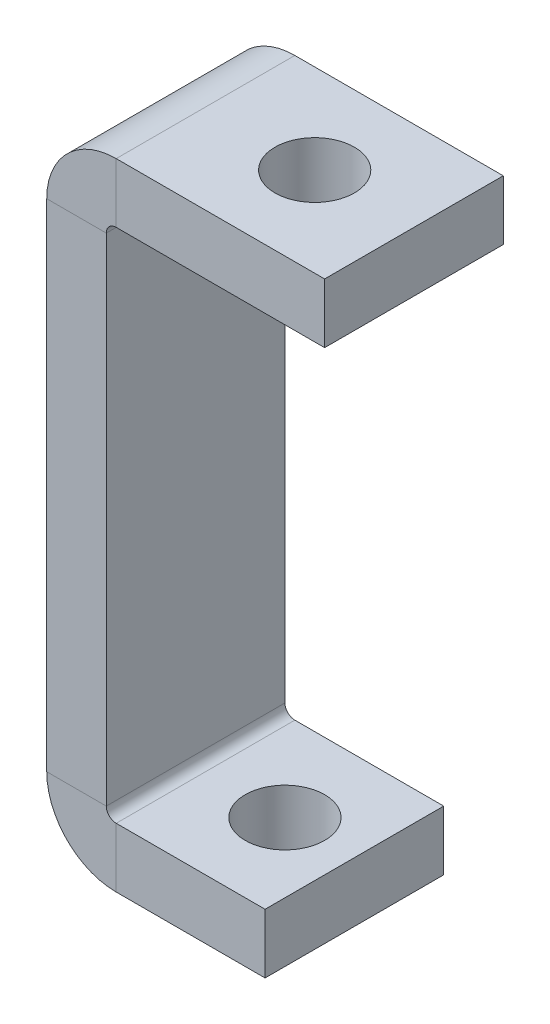
from build123d import *

# Parameters (mm, degrees)
SKETCH2_W          = 9
SKETCH2_H          = 3
SKETCH7_R          = 2
CUT_EXTRUDE1_DEPTH = 10
SKETCH8_R          = 2
CUT_EXTRUDE2_DEPTH = 10


with BuildPart() as part:
    # Sweep1: sweep along a path in Sketch1
    with BuildLine(Plane.XY) as sweep1_path:
        Line((0, 0), (-7.5, 0))
        ThreePointArc((-7.5, 0), (-7.853553391, 0.146446609), (-8, 0.5))
        Line((-8, 0.5), (-8, 25.5))
        ThreePointArc((-8, 25.5), (-7.853553391, 25.853553391), (-7.5, 26))
        Line((-7.5, 26), (3, 26))
    # Sketch2 → Sweep1 (sweep)
    with BuildSketch(Plane(origin=(0, 0, 0), x_dir=(0, 0, -1), z_dir=(1, 0, 0))):
        with Locations((0, -1.5)):
            Rectangle(SKETCH2_W, SKETCH2_H)
    sweep(path=sweep1_path.line)

    # Sketch7 → Cut-Extrude1 (cut)
    with BuildSketch(Plane(origin=(0, 29, 0), x_dir=(1, 0, 0), z_dir=(0, 1, 0))):
        with Locations(Location((-2, 0, 0), (0, 0, 180))):
            Circle(SKETCH7_R)
    extrude(amount=-CUT_EXTRUDE1_DEPTH, mode=Mode.SUBTRACT)

    # Sketch8 → Cut-Extrude2 (cut)
    with BuildSketch(Plane(origin=(0, -3, 0), x_dir=(-1, 0, 0), z_dir=(0, -1, 0))):
        with Locations(Location((3.5, 0, 0), (0, 0, 90))):
            Circle(SKETCH8_R)
    extrude(amount=-CUT_EXTRUDE2_DEPTH, mode=Mode.SUBTRACT)


solid = part.part
